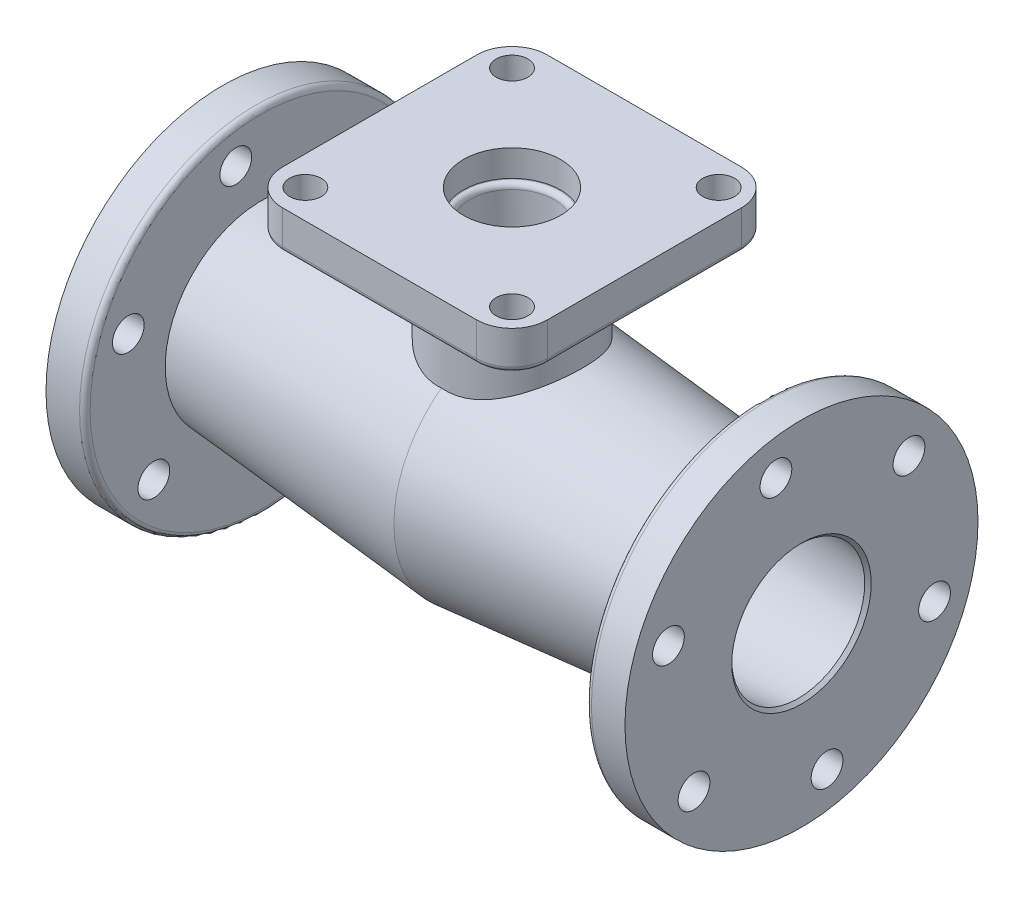
from build123d import *
from OCP.BRepFilletAPI import BRepFilletAPI_MakeChamfer

# Parameters (mm, degrees)
SKETCH3_R                 = 40
SKETCH3_R_2               = 9
BOSS_EXTRUDE1_DEPTH       = 22
BOSS_EXTRUDE3_REACH       = 303.198
SKETCH3_3_R               = 40
FILLET1_R                 = 3
CHAMFER1_SIZE             = 2
CHAMFER1_SIZE2            = 1.846124693
FILLET2_R                 = 3
F_5_0MM_DOWEL_HOLE1_D     = 18
F_5_0MM_DOWEL_HOLE1_DEPTH = 22
CIRPATTERN1_COUNT         = 6
MIRROR1_COPY_1_D          = 18
MIRROR1_COPY_1_DEPTH      = 22
MIRROR1_COPY_2_D          = 18
MIRROR1_COPY_2_DEPTH      = 22
MIRROR1_COPY_3_D          = 18
MIRROR1_COPY_3_DEPTH      = 22
MIRROR1_COPY_4_D          = 18
MIRROR1_COPY_4_DEPTH      = 22
MIRROR1_COPY_5_D          = 18
MIRROR1_COPY_5_DEPTH      = 22


with BuildPart() as part:
    # Sketch1 → Revolve1 (revolve)
    with BuildSketch(Plane.XY, mode=Mode.PRIVATE) as revolve1_sk:
        Polygon((0, -51.848140818), (-164, -37.5), (-164, -100), (-142, -100), (-142, -54.482048161), (0, -66.905438381), (142, -54.482048161), (142, -100), (164, -100), (164, -37.5), align=None)
    revolve(revolve1_sk.sketch.rotate(Axis((0, 0, 0), (-1, 0, 0)), 270), axis=Axis((0, 0, 0), (-1, 0, 0)))

    # Sketch3<3> → Boss-Extrude3 (add, up to next)
    with BuildSketch(Plane(origin=(0, 132, 0), x_dir=(1, 0, 0), z_dir=(0, 1, 0)), mode=Mode.PRIVATE) as boss_extrude3_sk1:
        with Locations(Location((0, 0, 0), (0, 0, 270))):
            Circle(SKETCH3_3_R)
    boss_extrude3_tool1 = extrude(boss_extrude3_sk1.sketch, amount=-BOSS_EXTRUDE3_REACH, mode=Mode.PRIVATE) - part.part


with BuildPart() as body_2:
    # Sketch3 → Boss-Extrude1 (new body)
    with BuildSketch(Plane(origin=(0, 132, 0), x_dir=(1, 0, 0), z_dir=(0, 1, 0))):
        with BuildLine():
            Line((-55, 75), (55, 75))
            ThreePointArc((55, 75), (69.142135624, 69.142135624), (75, 55))
            Line((75, 55), (75, -55))
            ThreePointArc((75, -55), (69.142135624, -69.142135624), (55, -75))
            Line((55, -75), (-55, -75))
            ThreePointArc((-55, -75), (-69.142135624, -69.142135624), (-75, -55))
            Line((-75, -55), (-75, 55))
            ThreePointArc((-75, 55), (-69.142135624, 69.142135624), (-55, 75))
        make_face()
        with Locations(Location((0, 0, 0), (0, 0, 270))):
            Circle(SKETCH3_R, mode=Mode.SUBTRACT)
        with Locations(Location((-58.539992601, -58.539992601, 0), (0, 0, 270))):
            Circle(SKETCH3_R_2, mode=Mode.SUBTRACT)
        with Locations(Location((58.539992601, -58.539992601, 0), (0, 0, 270))):
            Circle(SKETCH3_R_2, mode=Mode.SUBTRACT)
        with Locations(Location((58.539992601, 58.539992601, 0), (0, 0, 270))):
            Circle(SKETCH3_R_2, mode=Mode.SUBTRACT)
        with Locations(Location((-58.539992601, 58.539992601, 0), (0, 0, 270))):
            Circle(SKETCH3_R_2, mode=Mode.SUBTRACT)
    extrude(amount=-BOSS_EXTRUDE1_DEPTH)


with BuildPart() as part_1:
    add(part.part)

    add(body_2.part)  # Boss-Extrude3 merges body 2
    add(boss_extrude3_tool1.solids().sort_by_distance((0, 132, 0))[0])

    # Sketch4 → Cut-Revolve1 (revolve, cut)
    with BuildSketch(Plane.XY, mode=Mode.PRIVATE) as cut_revolve1_sk:
        Polygon((0, 0), (21.957757403, 0), (24, 117), (27.5, 117), (27.5, 132), (0, 132), align=None)
    revolve(cut_revolve1_sk.sketch.rotate(Axis((0, 0, 0), (0, -1, 0)), 180), axis=Axis((0, 0, 0), (0, -1, 0)), mode=Mode.SUBTRACT)

    # Fillet1
    fillet1_edges = [part_1.edges().sort_by_distance(p)[0] for p in [
        (142, 0, 100),
        (-69.142135624, 110, -69.142135624),
        (0, 110, -75),
        (69.142135624, 110, -69.142135624),
        (75, 110, 0),
        (69.142135624, 110, 69.142135624),
        (0, 110, 75),
        (-69.142135624, 110, 69.142135624),
        (-75, 110, 0),
        (-142, 0, 100),
    ]]
    fillet(fillet1_edges, radius=FILLET1_R)

    # Chamfer1: one chamfer whose edges measure the first distance from different faces: ONE call of the kernel's chamfer builder (chamfer() names one face for all edges)
    chamfer1_edges_1 = [part_1.edges().sort_by_distance(p)[0] for p in [
        (164, 0, 37.5),
    ]]
    chamfer1_side_1 = [part_1.faces().sort_by_distance(p)[0] for p in [
        (164, 0, 97.171572875),
    ]]
    chamfer1_edges_2 = [part_1.edges().sort_by_distance(p)[0] for p in [
        (-164, 0, 37.5),
    ]]
    chamfer1_side_2 = [part_1.faces().sort_by_distance(p)[0] for p in [
        (-82, 0, 44.674070409),
    ]]
    chamfer1 = BRepFilletAPI_MakeChamfer(part_1.part.solid().wrapped)
    for e in chamfer1_edges_1:
        chamfer1.Add(CHAMFER1_SIZE, CHAMFER1_SIZE2, e.wrapped, chamfer1_side_1[0].wrapped)  # the first distance lies on this face
    for e in chamfer1_edges_2:
        chamfer1.Add(CHAMFER1_SIZE, CHAMFER1_SIZE2, e.wrapped, chamfer1_side_2[0].wrapped)  # the first distance lies on this face
    add(Compound.cast(chamfer1.Shape()), mode=Mode.REPLACE)

    # Fillet2
    fillet2_edges = [part_1.edges().sort_by_distance(p)[0] for p in [
        (24, 117, 0),
    ]]
    fillet(fillet2_edges, radius=FILLET2_R)

    # Ø5.0mm Dowel Hole1
    with Locations(Plane(origin=(164, 0, 0), x_dir=(0, 0, -1), z_dir=(1, 0, 0))):
        with Locations((75.376061376, -26.803905898)):
            f_5_0mm_dowel_hole1 = Hole(F_5_0MM_DOWEL_HOLE1_D / 2, depth=F_5_0MM_DOWEL_HOLE1_DEPTH)

    # CirPattern1: Ø5.0mm Dowel Hole1 ×6 about axis
    cirpattern1_axis = Axis((0, 0, 0), (1, 0, 0))
    for i in range(1, CIRPATTERN1_COUNT):
        add(f_5_0mm_dowel_hole1.rotate(cirpattern1_axis, i * 360 / CIRPATTERN1_COUNT), mode=Mode.SUBTRACT)

    # Mirror1: Ø5.0mm Dowel Hole1 across plane
    add(f_5_0mm_dowel_hole1.mirror(Plane(origin=(0, 0, 0), x_dir=(0, 0, 1), z_dir=(1, 0, 0))), mode=Mode.SUBTRACT)

    # Mirror1 copy 1
    with Locations(Plane(origin=(-164, 0, 0), x_dir=(0, 0.8660254037844386, -0.5000000000000001), z_dir=(-1, 0, 0))):
        with Locations((75.376061376, 26.803905898)):
            Hole(MIRROR1_COPY_1_D / 2, depth=MIRROR1_COPY_1_DEPTH)

    # Mirror1 copy 2
    with Locations(Plane(origin=(-164, 0, 0), x_dir=(0, 0.8660254037844387, 0.4999999999999998), z_dir=(-1, 0, 0))):
        with Locations((75.376061376, 26.803905898)):
            Hole(MIRROR1_COPY_2_D / 2, depth=MIRROR1_COPY_2_DEPTH)

    # Mirror1 copy 3
    with Locations(Plane.ZY.offset(164)):
        with Locations((75.376061376, 26.803905898)):
            Hole(MIRROR1_COPY_3_D / 2, depth=MIRROR1_COPY_3_DEPTH)

    # Mirror1 copy 4
    with Locations(Plane(origin=(-164, 0, 0), x_dir=(0, -0.8660254037844384, 0.5000000000000004), z_dir=(-1, 0, 0))):
        with Locations((75.376061376, 26.803905898)):
            Hole(MIRROR1_COPY_4_D / 2, depth=MIRROR1_COPY_4_DEPTH)

    # Mirror1 copy 5
    with Locations(Plane(origin=(-164, 0, 0), x_dir=(0, -0.8660254037844386, -0.5000000000000001), z_dir=(-1, 0, 0))):
        with Locations((75.376061376, 26.803905898)):
            Hole(MIRROR1_COPY_5_D / 2, depth=MIRROR1_COPY_5_DEPTH)


solid = part_1.part
